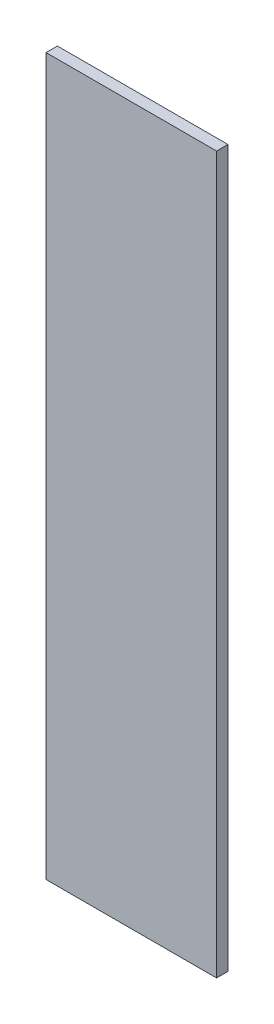
from build123d import *

# Parameters (mm, degrees)
SKETCH1_W     = 30
SKETCH1_H     = 126
PROFILE_DEPTH = 2


with BuildPart() as part:
    # Sketch1 → Profile (new body)
    with BuildSketch(Plane.XY):
        with Locations((15, 63)):
            Rectangle(SKETCH1_W, SKETCH1_H)
    extrude(amount=PROFILE_DEPTH)


solid = part.part
